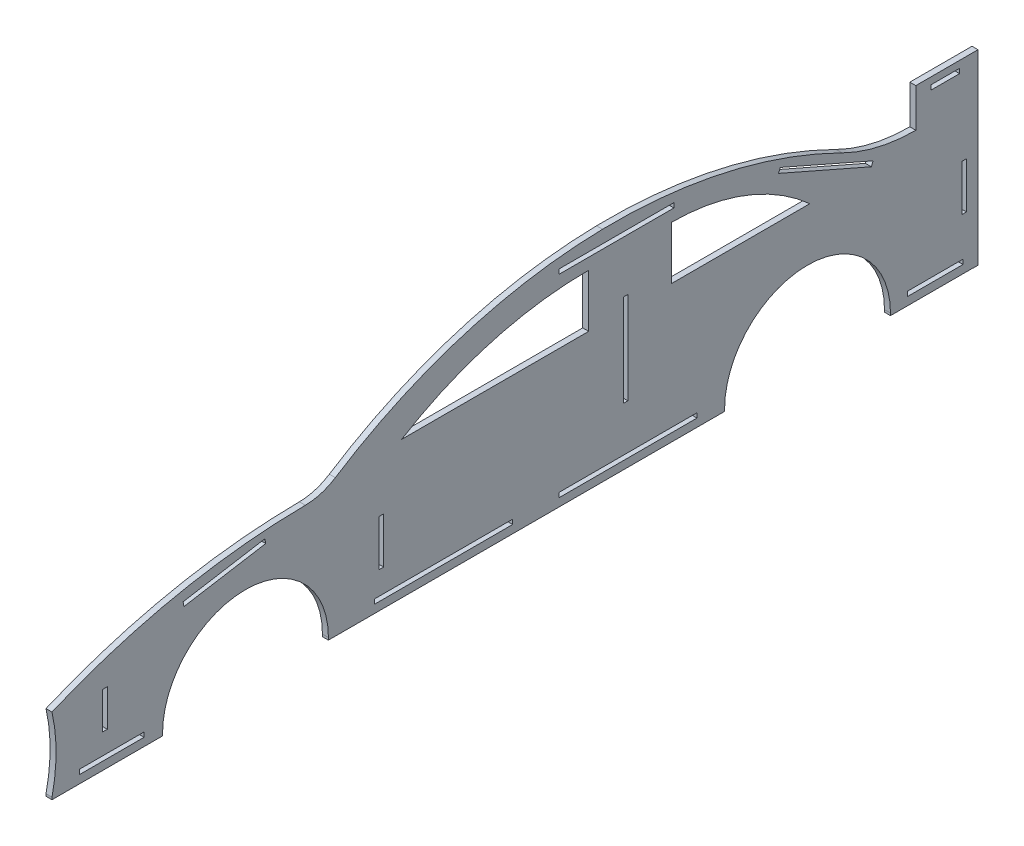
from build123d import *

# Parameters (mm, degrees)
BOSS_EXTRUDE1_DEPTH = 1.3
SKETCH2_W           = 6.25
SKETCH2_H           = 1
CUT_EXTRUDE1_DEPTH  = 128.618193671
SKETCH3_W           = 12
SKETCH3_H           = 1
SKETCH3_W_2         = 30
SKETCH3_W_3         = 14
SKETCH3_W_4         = 1
SKETCH3_H_2         = 8
CUT_EXTRUDE2_DEPTH  = 128.618193671
SKETCH4_W           = 1
SKETCH4_H           = 10
CUT_EXTRUDE3_DEPTH  = 128.618193671
SKETCH5_W           = 25
SKETCH5_H           = 1
SKETCH5_W_2         = 1
SKETCH5_H_2         = 20
CUT_EXTRUDE4_DEPTH  = 128.618193671
SKETCH6_W           = 1
SKETCH6_H           = 10
CUT_EXTRUDE5_DEPTH  = 128.618193671
SKETCH7_W           = 24
SKETCH7_H           = 0.5
SKETCH7_W_2         = 86
SKETCH7_W_3         = 18
BOSS_EXTRUDE2_DEPTH = 1.3
CUT_EXTRUDE6_DEPTH  = 128.618193671
SKETCH10_W          = 1
SKETCH10_H          = 40.53071679
BOSS_EXTRUDE3_DEPTH = 1.3


with BuildPart() as part:
    # Sketch1 → Boss-Extrude1 (new body)
    with BuildSketch(Plane(origin=(0, 0, 0), x_dir=(0, 0, -1), z_dir=(1, 0, 0))):
        with BuildLine():
            Line((81.367510562, 0), (81.367510562, 40))
            Line((81.367510562, 40), (68.86751224, 40))
            Line((68.86751224, 40), (68.86751224, 31.6))
            ThreePointArc((68.86751224, 31.6), (60.650673838, 32.5501447), (52.86751224, 35.350431081))
            ThreePointArc((52.86751224, 35.350431081), (27.570153703, 44.311585339), (0.86751224, 47))
            ThreePointArc((0.86751224, 47), (-29.363130095, 42.186071485), (-57.13248776, 29.304750955))
            ThreePointArc((-57.13248776, 29.304750955), (-60.244560512, 27.872141345), (-63.63248776, 27.362910487))
            ThreePointArc((-63.63248776, 27.362910487), (-91.690071427, 24.380332585), (-118.63248776, 16))
            ThreePointArc((-118.63248776, 16), (-117.739294054, 7.999999906), (-118.632489438, 0))
            Line((-118.632489438, 0), (-94.632489438, 0))
            ThreePointArc((-94.632489438, 0), (-76.632489438, 18), (-58.632489438, 0))
            Line((-58.632489438, 0), (27.367510562, 0))
            ThreePointArc((27.367510562, 0), (45.367510562, 18), (63.367510562, 0))
            Line((63.367510562, 0), (81.367510562, 0))
        make_face()
        with BuildLine():
            Line((-42.73248776, 29.304750955), (-2.13248776, 29.304750955))
            Line((-2.13248776, 29.304750955), (-2.13248776, 40.804750955))
            ThreePointArc((-2.13248776, 40.804750955), (-23.231125157, 37.874288199), (-42.73248776, 29.304750955))
        make_face(mode=Mode.SUBTRACT)
    extrude(amount=BOSS_EXTRUDE1_DEPTH)

    # Sketch2 → Cut-Extrude1 (cut, through all)
    with BuildSketch(Plane(origin=(1.3, 0, 0), x_dir=(0, 0, -1), z_dir=(1, 0, 0))):
        with Locations((75.242510562, 38)):
            Rectangle(SKETCH2_W, SKETCH2_H)
    extrude(amount=-CUT_EXTRUDE1_DEPTH, mode=Mode.SUBTRACT)

    # Sketch3 → Cut-Extrude2 (cut, through all)
    with BuildSketch(Plane(origin=(1.3, 0, 0), x_dir=(0, 0, -1), z_dir=(1, 0, 0))):
        with Locations((73.117510562, 1.75)):
            Rectangle(SKETCH3_W, SKETCH3_H)
        with Locations((6.367510562, 1.75)):
            Rectangle(SKETCH3_W_2, SKETCH3_H)
        with Locations((-105.632489438, 1.75)):
            Rectangle(SKETCH3_W_3, SKETCH3_H)
        Polygon((-90.165047606, 22.486285602), (-72.411906778, 25.457142507), (-72.246859172, 24.470856905), (-90, 21.5), align=None)
        with Locations((-107.132489438, 10.75)):
            Rectangle(SKETCH3_W_4, SKETCH3_H_2)
        Polygon((39.458953443, 39.317791271), (59.607847956, 30.484782164), (59.206347542, 29.568923322), (39.057453029, 38.40193243), align=None)
        with Locations((-33.632489438, 1.75)):
            Rectangle(SKETCH3_W_2, SKETCH3_H)
    extrude(amount=-CUT_EXTRUDE2_DEPTH, mode=Mode.SUBTRACT)

    # Sketch4 → Cut-Extrude3 (cut, through all)
    with BuildSketch(Plane(origin=(1.3, 0, 0), x_dir=(0, 0, -1), z_dir=(1, 0, 0))):
        with Locations((79.367510562, 15.75)):
            Rectangle(SKETCH4_W, SKETCH4_H)
    extrude(amount=-CUT_EXTRUDE3_DEPTH, mode=Mode.SUBTRACT)

    # Sketch5 → Cut-Extrude4 (cut, through all)
    with BuildSketch(Plane(origin=(1.3, 0, 0), x_dir=(0, 0, -1), z_dir=(1, 0, 0))):
        with Locations((3.867510562, 43.75)):
            Rectangle(SKETCH5_W, SKETCH5_H)
        with Locations((5.867510562, 22)):
            Rectangle(SKETCH5_W_2, SKETCH5_H_2)
    extrude(amount=-CUT_EXTRUDE4_DEPTH, mode=Mode.SUBTRACT)

    # Sketch6 → Cut-Extrude5 (cut, through all)
    with BuildSketch(Plane(origin=(1.3, 0, 0), x_dir=(0, 0, -1), z_dir=(1, 0, 0))):
        with Locations((-47.132489438, 12.25)):
            Rectangle(SKETCH6_W, SKETCH6_H)
    extrude(amount=-CUT_EXTRUDE5_DEPTH, mode=Mode.SUBTRACT)

    # Sketch7 → Boss-Extrude2 (add)
    with BuildSketch(Plane(origin=(0, 0, 0), x_dir=(0, 0, -1), z_dir=(1, 0, 0))):
        with Locations((-106.632489438, -0.25)):
            Rectangle(SKETCH7_W, SKETCH7_H)
        with Locations((-15.632489438, -0.25)):
            Rectangle(SKETCH7_W_2, SKETCH7_H)
        with Locations((72.367510562, -0.25)):
            Rectangle(SKETCH7_W_3, SKETCH7_H)
    extrude(amount=BOSS_EXTRUDE2_DEPTH)

    # Sketch9 → Cut-Extrude6 (cut, through all)
    with BuildSketch(Plane(origin=(1.3, 0, 0), x_dir=(0, 0, -1), z_dir=(1, 0, 0))):
        with BuildLine():
            Line((15.86751224, 40.804750955), (15.86751224, 29.304750955))
            Line((15.86751224, 29.304750955), (45.86751224, 29.304750955))
            ThreePointArc((45.86751224, 29.304750955), (31.931836066, 37.831247893), (15.86751224, 40.804750955))
        make_face()
    extrude(amount=-CUT_EXTRUDE6_DEPTH, mode=Mode.SUBTRACT)

    # Sketch10 → Boss-Extrude3 (add)
    with BuildSketch(Plane(origin=(0, 0, 0), x_dir=(0, 0, -1), z_dir=(1, 0, 0))):
        with Locations((81.867510562, 19.734641605)):
            Rectangle(SKETCH10_W, SKETCH10_H)
    extrude(amount=BOSS_EXTRUDE3_DEPTH)


solid = part.part
